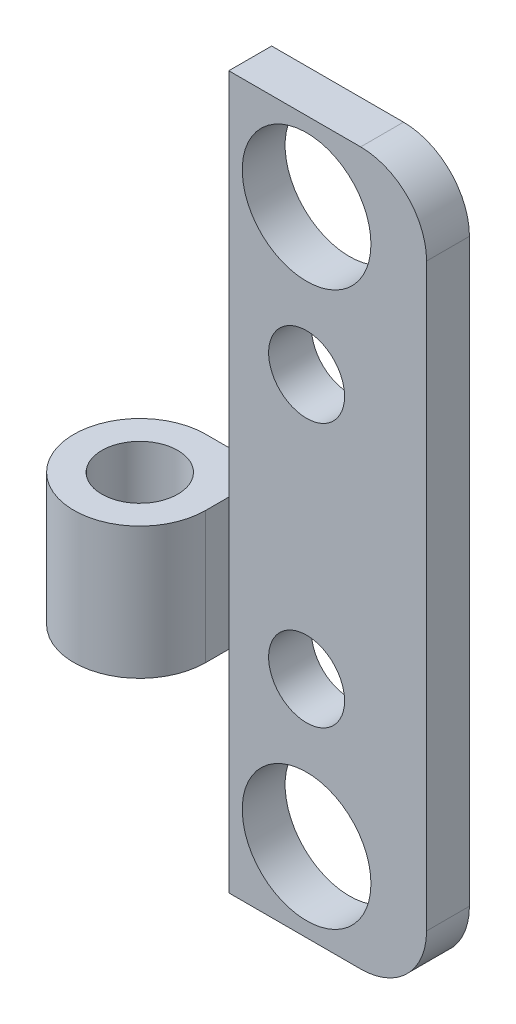
from build123d import *

# Parameters (mm, degrees)
SKETCH1_R           = 6.1976
BOSS_EXTRUDE1_DEPTH = 4.1275
BOSS_EXTRUDE2_START = -35.56
SKETCH2_R           = 3.6576
BOSS_EXTRUDE2_DEPTH = 12.7
SKETCH3_R           = 3.6576
CUT_EXTRUDE1_DEPTH  = 72.691050043


with BuildPart() as part:
    # Sketch1 → Boss-Extrude1 (new body)
    with BuildSketch(Plane.XY):
        with BuildLine():
            Line((0, 0), (12.7, 0))
            ThreePointArc((12.7, 0), (17.190128061, 1.859871939), (19.05, 6.35))
            Line((19.05, 6.35), (19.05, 62.23))
            ThreePointArc((19.05, 62.23), (17.190128061, 66.720128061), (12.7, 68.58))
            Line((12.7, 68.58), (0, 68.58))
            Line((0, 68.58), (0, 0))
        make_face()
        with Locations((7.493, 60.96)):
            Circle(SKETCH1_R, mode=Mode.SUBTRACT)
        with Locations((7.493, 7.62)):
            Circle(SKETCH1_R, mode=Mode.SUBTRACT)
    extrude(amount=BOSS_EXTRUDE1_DEPTH)

    # Sketch2 → Boss-Extrude2 (add)
    with BuildSketch(Plane(origin=(0, 68.58, 0), x_dir=(1, 0, 0), z_dir=(0, 1, 0)).offset(BOSS_EXTRUDE2_START)):
        with BuildLine():
            Line((0, 0), (-6.35, 0))
            ThreePointArc((-6.35, 0), (-10.840128061, -10.840128061), (0, -6.35))
            Line((0, -6.35), (0, -4.1275))
            Line((0, -4.1275), (0, 0))
        make_face()
        with Locations(Location((-6.35, -6.35, 0), (0, 0, 270))):
            Circle(SKETCH2_R, mode=Mode.SUBTRACT)
    extrude(amount=-BOSS_EXTRUDE2_DEPTH)

    # Sketch3 → Cut-Extrude1 (cut, through all)
    with BuildSketch(Plane.XY.offset(4.1275)):
        with Locations((7.493, 46.99)):
            Circle(SKETCH3_R)
        with Locations((7.493, 21.59)):
            Circle(SKETCH3_R)
    extrude(amount=-CUT_EXTRUDE1_DEPTH, mode=Mode.SUBTRACT)


solid = part.part
